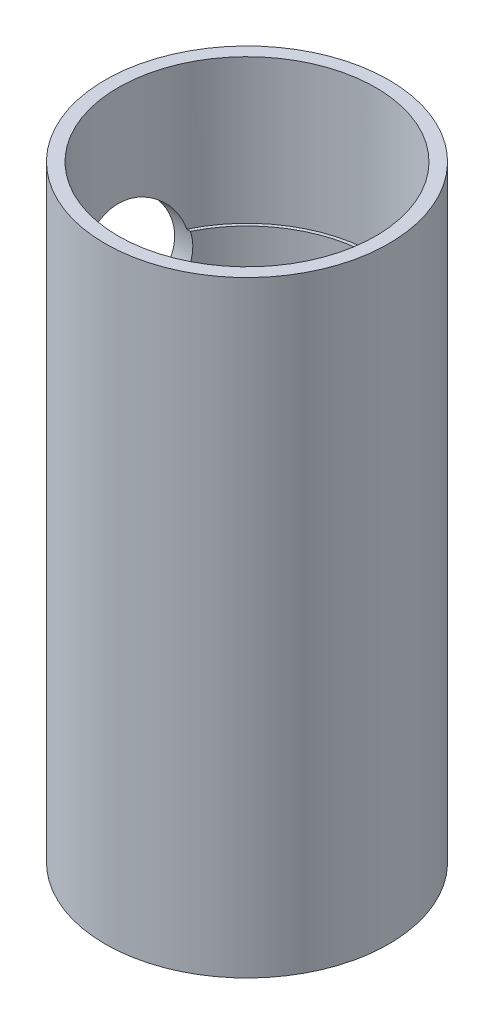
from build123d import *

# Parameters (mm, degrees)
SKETCH1_R           = 43.25
SKETCH1_R_2         = 38.25
BOSS_EXTRUDE1_DEPTH = 92.5
BOSS_EXTRUDE2_START = -6.35
SKETCH2_R           = 38.25
SKETCH2_R_2         = 36.25
BOSS_EXTRUDE2_DEPTH = 100
CUT_EXTRUDE3_START  = -44
SKETCH6_R           = 39.25
SKETCH6_R_2         = 38.25
CUT_EXTRUDE3_DEPTH  = 44
SKETCH7_R           = 17.5
CUT_EXTRUDE4_DEPTH  = 111.893530019


with BuildPart() as part:
    # Sketch1 → Boss-Extrude1 (new, symmetric)
    with BuildSketch(Plane(origin=(0, 0, 0), x_dir=(1, 0, 0), z_dir=(0, 1, 0))):
        with Locations(Location((0, 0, 0), (0, 0, 270))):
            Circle(SKETCH1_R)
        with Locations(Location((0, 0, 0), (0, 0, 270))):
            Circle(SKETCH1_R_2, mode=Mode.SUBTRACT)
    extrude(amount=BOSS_EXTRUDE1_DEPTH, both=True)

    # Sketch2 → Boss-Extrude2 (add)
    with BuildSketch(Plane.XZ.offset(92.5).offset(BOSS_EXTRUDE2_START)):
        with Locations(Location((0, 0, 0), (0, 0, 270))):
            Circle(SKETCH2_R)
        with Locations(Location((0, 0, 0), (0, 0, 270))):
            Circle(SKETCH2_R_2, mode=Mode.SUBTRACT)
    extrude(amount=-BOSS_EXTRUDE2_DEPTH)

    # Sketch6 → Cut-Extrude3 (cut)
    with BuildSketch(Plane(origin=(0, 92.5, 0), x_dir=(1, 0, 0), z_dir=(0, 1, 0)).offset(CUT_EXTRUDE3_START)):
        with Locations(Location((0, 0, 0), (0, 0, 270))):
            Circle(SKETCH6_R)
        with Locations(Location((0, 0, 0), (0, 0, 90))):
            Circle(SKETCH6_R_2, mode=Mode.SUBTRACT)
    extrude(amount=CUT_EXTRUDE3_DEPTH, mode=Mode.SUBTRACT)

    # Sketch7 → Cut-Extrude4 (cut, through all)
    with BuildSketch(Plane(origin=(0, 0, 0), x_dir=(0, 0, -1), z_dir=(1, 0, 0))):
        with Locations(Location((0, 44.35, 0), (0, 0, 13.717970606))):
            Circle(SKETCH7_R)
    extrude(amount=-CUT_EXTRUDE4_DEPTH, mode=Mode.SUBTRACT)


solid = part.part
